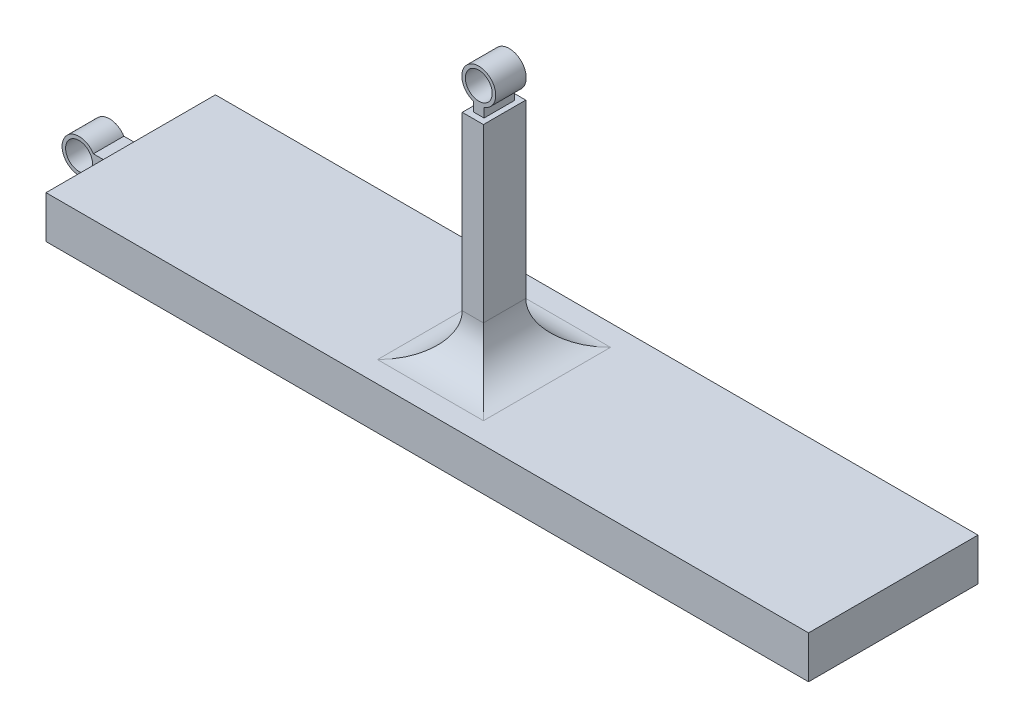
from build123d import *

# Parameters (mm, degrees)
SKETCH1_W           = 900
SKETCH1_H           = 50
BOSS_EXTRUDE1_DEPTH = 200
BOSS_EXTRUDE2_START = -82
SKETCH4_R           = 20
SKETCH4_R_2         = 15.875
BOSS_EXTRUDE2_DEPTH = 36
SKETCH8_W           = 25
SKETCH8_H           = 252.75
BOSS_EXTRUDE3_DEPTH = 25
FILLET1_R           = 50
SKETCH9_R           = 15.875
BOSS_EXTRUDE4_DEPTH = 18


with BuildPart() as part:
    # Sketch1 → Boss-Extrude1 (new body)
    with BuildSketch(Plane.XY):
        with Locations((370.54501266, -26.765800796)):
            Rectangle(SKETCH1_W, SKETCH1_H)
    extrude(amount=BOSS_EXTRUDE1_DEPTH)

    # Sketch4 → Boss-Extrude2 (add)
    # profile 1 of 2: a face of its own
    with BuildSketch(Plane(origin=(0, 0, 0), x_dir=(-1, 0, 0), z_dir=(0, 0, -1)).offset(BOSS_EXTRUDE2_START)):
        with BuildLine():
            Line((79.45498734, -16.105071334), (79.45498734, -26.765800796))
            Line((79.45498734, -26.765800796), (79.45498734, -39.539290307))
            Line((79.45498734, -39.539290307), (107.065446551, -39.539290307))
            ThreePointArc((107.065446551, -39.539290307), (102.497605949, -28.070763635), (105.53314207, -16.105071334))
            Line((105.53314207, -16.105071334), (79.45498734, -16.105071334))
        make_face()
    # profile 2 of 2: a face of its own
    with BuildSketch(Plane(origin=(0, 0, 0), x_dir=(-1, 0, 0), z_dir=(0, 0, -1)).offset(BOSS_EXTRUDE2_START)):
        with Locations((122.45498734, -26.765800796)):
            Circle(SKETCH4_R)
        with Locations((122.45498734, -26.765800796)):
            Circle(SKETCH4_R_2, mode=Mode.SUBTRACT)
    extrude(amount=-BOSS_EXTRUDE2_DEPTH)

    # Sketch8 → Boss-Extrude3 (add, symmetric)
    with BuildSketch(Plane.XY.offset(100)):
        with Locations((349.31501266, 124.609199204)):
            Rectangle(SKETCH8_W, SKETCH8_H)
    extrude(amount=BOSS_EXTRUDE3_DEPTH, both=True)

    # Fillet1
    fillet1_edges = [part.edges().sort_by_distance(p)[0] for p in [
        (349.31501266, -1.765800796, 75),
        (336.81501266, -1.765800796, 100),
        (361.81501266, -1.765800796, 100),
        (349.31501266, -1.765800796, 125),
    ]]
    fillet(fillet1_edges, radius=FILLET1_R)

    # Sketch9 → Boss-Extrude4 (add, symmetric)
    with BuildSketch(Plane.XY.offset(100)):
        with BuildLine():
            Line((343.39732273, 250.984199204), (355.564186934, 250.984199204))
            Line((355.564186934, 250.984199204), (355.564186934, 261.985572388))
            ThreePointArc((355.564186934, 261.985572388), (349.141025878, 300.983442405), (343.39732273, 261.879724705))
            Line((343.39732273, 261.879724705), (343.39732273, 250.984199204))
        make_face()
        with Locations((349.31501266, 280.984199204)):
            Circle(SKETCH9_R, mode=Mode.SUBTRACT)
    extrude(amount=BOSS_EXTRUDE4_DEPTH, both=True)


solid = part.part
